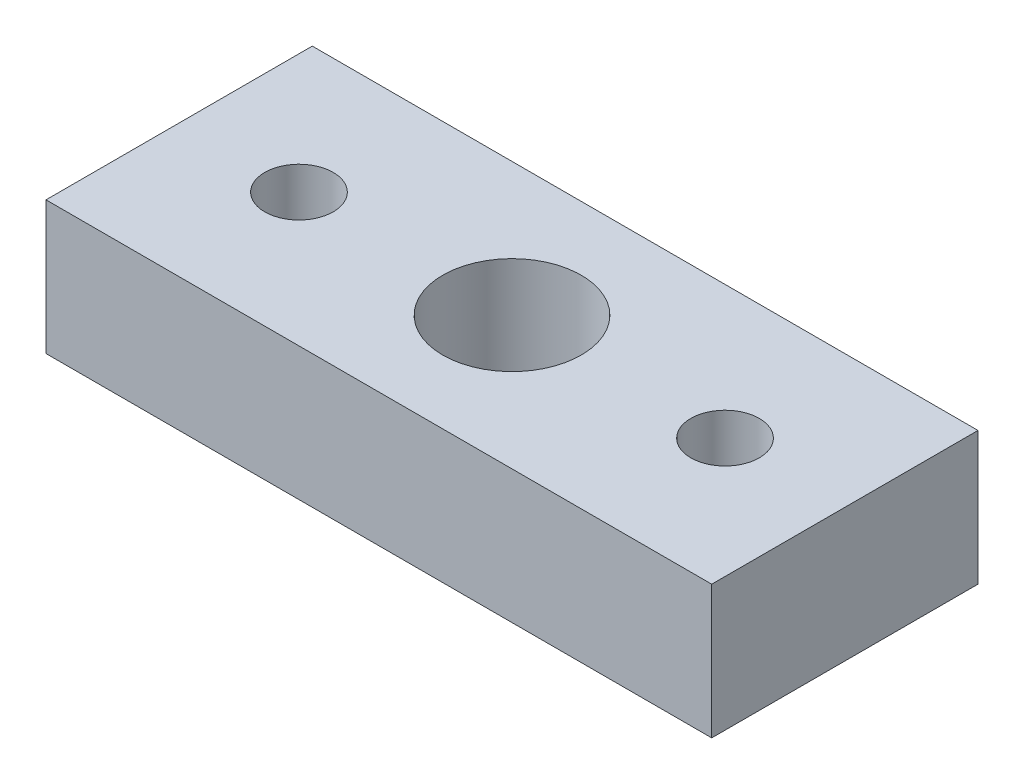
from build123d import *

# Parameters (mm, degrees)
SKETCH1_W             = 31.75
SKETCH1_H             = 12.7
BOSS_EXTRUDE1_DEPTH   = 6.35
CUT_EXTRUDE1_REACH    = 20.239
SKETCH2_R             = 3.302
F_4_CLEARANCE_HOLE1_D = 3.2639


with BuildPart() as part:
    # Sketch1 → Boss-Extrude1 (new body)
    with BuildSketch(Plane(origin=(0, 0, 0), x_dir=(1, 0, 0), z_dir=(0, 1, 0))):
        Rectangle(SKETCH1_W, SKETCH1_H)
    extrude(amount=BOSS_EXTRUDE1_DEPTH)

    # Sketch2 → Cut-Extrude1 (cut, up to next)
    with BuildSketch(Plane(origin=(0, 6.35, 0), x_dir=(1, 0, 0), z_dir=(0, 1, 0)), mode=Mode.PRIVATE) as cut_extrude1_sk1:
        with Locations(Location((0, 0, 0), (0, 0, 270))):
            Circle(SKETCH2_R)
    cut_extrude1_tool1 = extrude(cut_extrude1_sk1.sketch, amount=-CUT_EXTRUDE1_REACH, mode=Mode.PRIVATE) & part.part
    add(cut_extrude1_tool1.solids().sort_by_distance((0, 6.35, 0))[0], mode=Mode.SUBTRACT)

    # #4 Clearance Hole1 (through all)
    with Locations(Plane(origin=(0, 6.35, 0), x_dir=(1, 0, 0), z_dir=(0, 1, 0))):
        with Locations((-10.16, 0)):
            f_4_clearance_hole1 = Hole(F_4_CLEARANCE_HOLE1_D / 2)

    # Mirror1: #4 Clearance Hole1 across plane
    add(f_4_clearance_hole1.mirror(Plane(origin=(0, 0, 0), x_dir=(0, 0, 1), z_dir=(1, 0, 0))), mode=Mode.SUBTRACT)


solid = part.part
